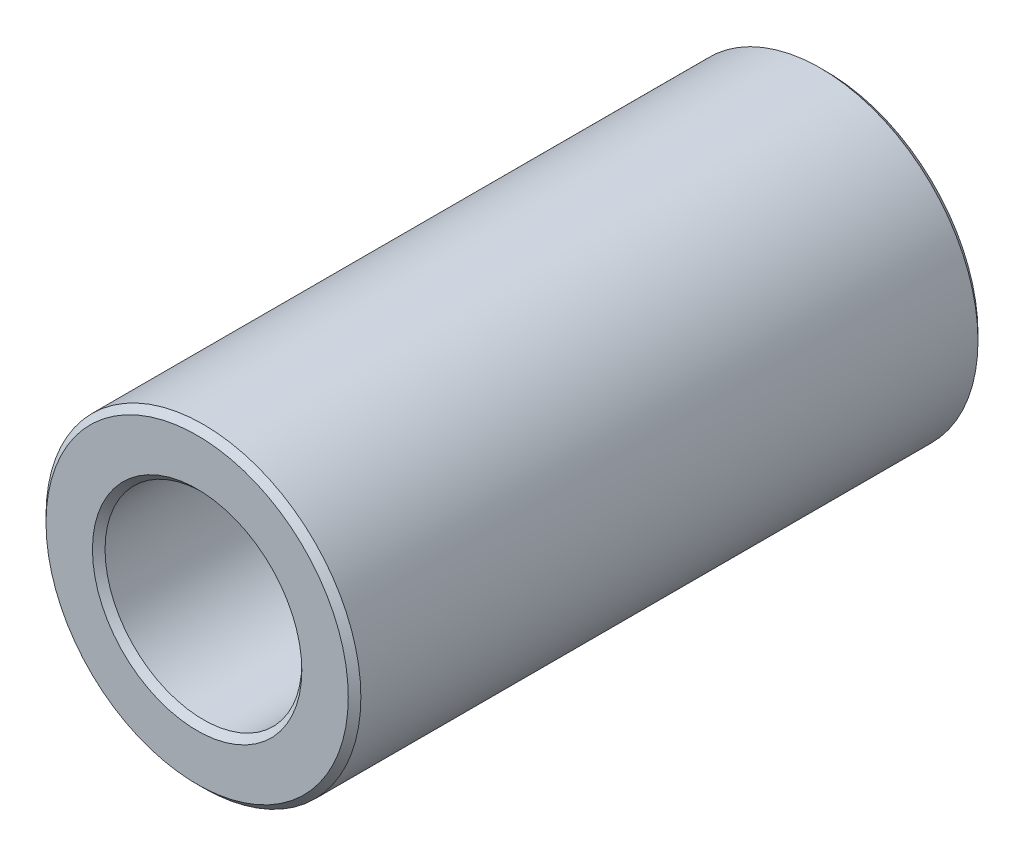
from build123d import *

# Parameters (mm, degrees)
CHAMFER1_SIZE = 0.254
CHAMFER2_SIZE = 0.127


with BuildPart() as part:
    # Sketch1 → Revolve1 (revolve)
    with BuildSketch(Plane(origin=(0, 0, 0), x_dir=(0, 0, -1), z_dir=(1, 0, 0)), mode=Mode.PRIVATE) as revolve1_sk:
        Polygon((0, 6.35), (25.4, 6.35), (25.4, 4.6736), (15.24, 4.6736), (15.24, 3.96875), (0, 3.96875), align=None)
    revolve(revolve1_sk.sketch.rotate(Axis((0, 0, 0), (0, 0, -1)), 90), axis=Axis((0, 0, 0), (0, 0, -1)))

    # Chamfer1
    chamfer1_edges = [part.edges().sort_by_distance(p)[0] for p in [
        (-3.96875, 0, 0),
        (-4.6736, 0, -25.4),
        (-6.35, 0, -25.4),
        (-6.35, 0, 0),
    ]]
    chamfer(chamfer1_edges, length=CHAMFER1_SIZE)

    # Chamfer2
    chamfer2_edges = [part.edges().sort_by_distance(p)[0] for p in [
        (-3.96875, 0, -15.24),
    ]]
    chamfer(chamfer2_edges, length=CHAMFER2_SIZE)


solid = part.part
